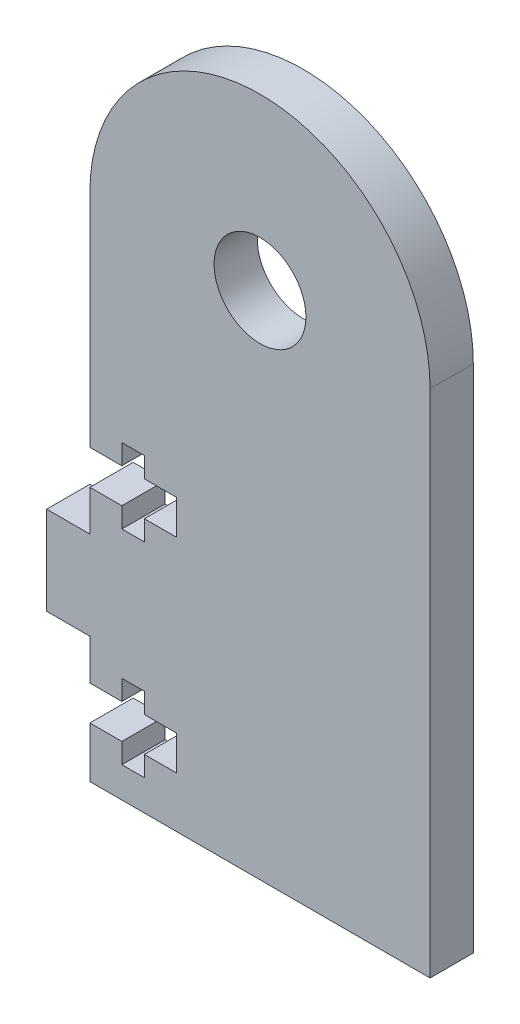
from build123d import *

# Parameters (mm, degrees)
BOSS_EXTRUDE1_DEPTH = 6.35
CUT_EXTRUDE1_DEPTH  = 6.35
LPATTERN1_COUNT     = 2
LPATTERN1_PITCH     = 30
SKETCH4_W           = 6.35
SKETCH4_H           = 13
BOSS_EXTRUDE2_DEPTH = 6.35
SKETCH5_R           = 6.75
CUT_EXTRUDE2_DEPTH  = 82.536157623


with BuildPart() as part:
    # Sketch2 → Boss-Extrude1 (new body)
    with BuildSketch(Plane.XY):
        with BuildLine():
            Line((-25, 0), (-25, -75))
            Line((-25, -75), (25, -75))
            Line((25, -75), (25, 0))
            ThreePointArc((25, 0), (0, 25), (-25, 0))
        make_face()
    extrude(amount=BOSS_EXTRUDE1_DEPTH)

    # Sketch3 → Cut-Extrude1 (cut)
    with BuildSketch(Plane.XY.offset(6.35)):
        Polygon((-12.3, -67.54), (-16.999, -67.54), (-16.999, -70.4991), (-20.301, -70.4991), (-20.301, -67.54), (-25, -67.54), (-25, -62.46), (-20.301, -62.46), (-20.301, -59.5009), (-16.999, -59.5009), (-16.999, -62.46), (-12.3, -62.46), align=None)
    cut_extrude1 = extrude(amount=-CUT_EXTRUDE1_DEPTH, mode=Mode.SUBTRACT)

    # LPattern1: Cut-Extrude1 ×2
    with Locations(*[(0, i * LPATTERN1_PITCH, 0) for i in range(1, LPATTERN1_COUNT)]):
        add(cut_extrude1, mode=Mode.SUBTRACT)

    # Sketch4 → Boss-Extrude2 (add)
    with BuildSketch(Plane.XY.offset(6.35)):
        with Locations((-28.175, -50)):
            Rectangle(SKETCH4_W, SKETCH4_H)
    extrude(amount=-BOSS_EXTRUDE2_DEPTH)

    # Sketch5 → Cut-Extrude2 (cut, through all)
    with BuildSketch(Plane.XY.offset(6.35)):
        Circle(SKETCH5_R)
    extrude(amount=-CUT_EXTRUDE2_DEPTH, mode=Mode.SUBTRACT)


solid = part.part
